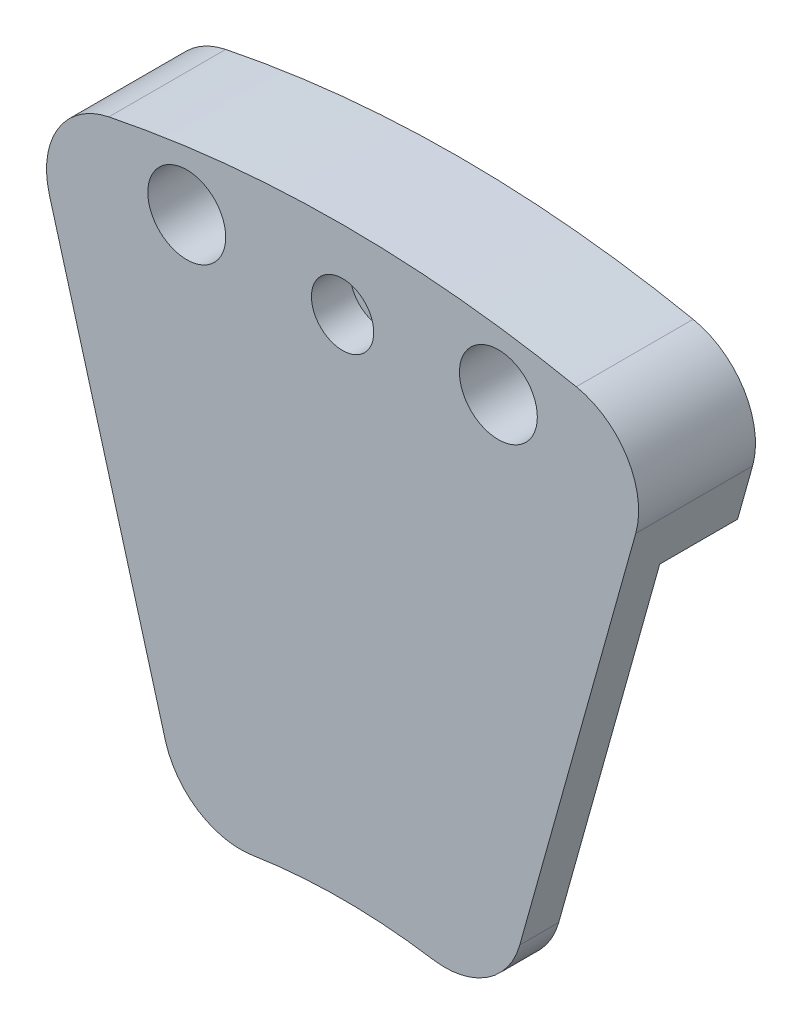
from build123d import *

# Parameters (mm, degrees)
EXTRUDE_1_DEPTH     = 5
EXTRUDE_START       = 10
EXTRUDE_2_DEPTH     = 10
SKETCH_3_R          = 2.15
CUT_EXTRUDE_1_DEPTH = 50
SKETCH_4_R          = 5
CUT_EXTRUDE_2_DEPTH = 10


with BuildPart() as part:
    # 草图1 → 凸台-拉伸1 (new body)
    with BuildSketch(Plane.XY):
        with BuildLine():
            Line((-37.630075072, 134.476679949), (-22.746271228, 81.287189306))
            ThreePointArc((-22.746271228, 81.287189306), (-19.159893018, 76.014894835), (-13.116196156, 73.981934953))
            ThreePointArc((-13.116196156, 73.981934953), (-12.342334545, 74.011923006), (-11.573114255, 74.101707311))
            ThreePointArc((-11.573114255, 74.101707311), (0, 75), (11.573114255, 74.101707311))
            ThreePointArc((11.573114255, 74.101707311), (12.342334545, 74.011923006), (13.116196156, 73.981934953))
            ThreePointArc((13.116196156, 73.981934953), (19.159893018, 76.014894835), (22.746271228, 81.287189306))
            Line((22.746271228, 81.287189306), (37.630075072, 134.476679949))
            ThreePointArc((37.630075072, 134.476679949), (36.534141944, 142.38375917), (30, 146.969384567))
            ThreePointArc((30, 146.969384567), (0, 150), (-30, 146.969384567))
            ThreePointArc((-30, 146.969384567), (-36.534141944, 142.38375917), (-37.630075072, 134.476679949))
        make_face()
        with BuildLine():
            ThreePointArc((0, 144), (-4, 140), (0, 136))
            ThreePointArc((0, 136), (4, 140), (0, 144))
        make_face(mode=Mode.SUBTRACT)
    extrude(amount=EXTRUDE_1_DEPTH)

    # 草图2 → 凸台-拉伸2 (add)
    with BuildSketch(Plane(origin=(0, 0, 0), x_dir=(-1, 0, 0), z_dir=(0, 0, -1)).offset(EXTRUDE_START)):
        with BuildLine():
            Line((37.630075072, 134.476679949), (35.705379823, 127.598494708))
            ThreePointArc((35.705379823, 127.598494708), (0, 132.5), (-35.705379823, 127.598494708))
            Line((-35.705379823, 127.598494708), (-37.630075072, 134.476679949))
            ThreePointArc((-37.630075072, 134.476679949), (-36.534141944, 142.38375917), (-30, 146.969384567))
            ThreePointArc((-30, 146.969384567), (0, 150), (30, 146.969384567))
            ThreePointArc((30, 146.969384567), (36.534141944, 142.38375917), (37.630075072, 134.476679949))
        make_face()
    extrude(amount=-EXTRUDE_2_DEPTH)

    # 草图3 → 切除-拉伸1 (cut)
    with BuildSketch(Plane.XY.offset(5)):
        with Locations((-20, 141.089510595)):
            Circle(SKETCH_3_R)
        with Locations((20, 141.089510595)):
            Circle(SKETCH_3_R)
    extrude(amount=-CUT_EXTRUDE_1_DEPTH, mode=Mode.SUBTRACT)

    # 草图4 → 切除-拉伸2 (cut)
    with BuildSketch(Plane.XY.offset(5)):
        with Locations((-20, 141.089510595)):
            Circle(SKETCH_4_R)
        with Locations((20, 141.089510595)):
            Circle(SKETCH_4_R)
    extrude(amount=-CUT_EXTRUDE_2_DEPTH, mode=Mode.SUBTRACT)


solid = part.part
